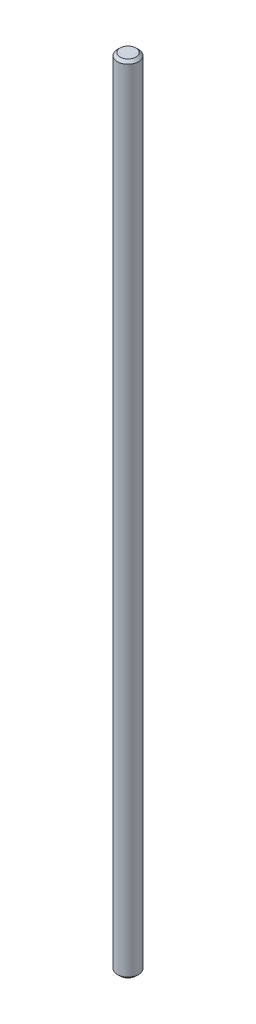
from build123d import *

# Parameters (mm, degrees)
SKETCH1_R           = 4
BOSS_EXTRUDE1_DEPTH = 300
CHAMFER1_SIZE       = 1


with BuildPart() as part:
    # Sketch1 → Boss-Extrude1 (new body)
    with BuildSketch(Plane(origin=(0, 0, 0), x_dir=(1, 0, 0), z_dir=(0, 1, 0))):
        with Locations(Location((0, 0, 0), (0, 0, 270))):
            Circle(SKETCH1_R)
    extrude(amount=BOSS_EXTRUDE1_DEPTH)

    # Chamfer1
    chamfer1_edges = [part.edges().sort_by_distance(p)[0] for p in [
        (0, 0, -4),
        (0, 300, -4),
    ]]
    chamfer(chamfer1_edges, length=CHAMFER1_SIZE)


solid = part.part
